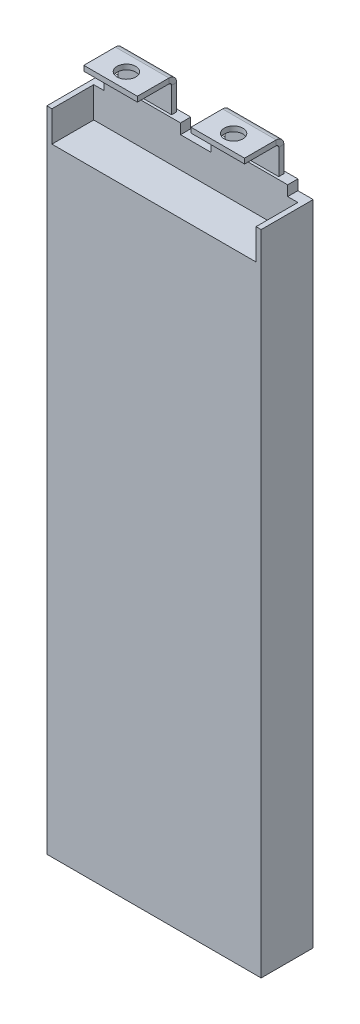
from build123d import *

# Parameters (mm, degrees)
SKETCH1_W                 = 42
SKETCH1_H                 = 127
BOSS_EXTRUDE1_DEPTH       = 5.1
SKETCH2_W                 = 40
SKETCH2_H                 = 6
CUT_EXTRUDE1_DEPTH        = 8.2
SKETCH3_W                 = 15
SKETCH3_H                 = 2
BOSS_EXTRUDE2_DEPTH       = 1
TAB_PROFILE_W             = 10.5
TAB_PROFILE_H             = 1
F_6_CLEARANCE_HOLE1_D     = 3.6576
F_6_CLEARANCE_HOLE1_DEPTH = 1
F_6_CLEARANCE_HOLE2_D     = 3.6576
F_6_CLEARANCE_HOLE2_DEPTH = 1


with BuildPart() as part:
    # Sketch1 → Boss-Extrude1 (new, symmetric)
    with BuildSketch(Plane.XY):
        with Locations((0, 63.5)):
            Rectangle(SKETCH1_W, SKETCH1_H)
    extrude(amount=BOSS_EXTRUDE1_DEPTH, both=True)

    # Sketch2 → Cut-Extrude1 (cut)
    with BuildSketch(Plane.XY.offset(5.1)):
        with Locations((0, 124)):
            Rectangle(SKETCH2_W, SKETCH2_H)
    extrude(amount=-CUT_EXTRUDE1_DEPTH, mode=Mode.SUBTRACT)

    # Sketch3 → Boss-Extrude2 (add, symmetric)
    with BuildSketch(Plane(origin=(0, 0, -4.1), x_dir=(-1, 0, 0), z_dir=(0, 0, -1))):
        with Locations((-10.5, 128)):
            Rectangle(SKETCH3_W, SKETCH3_H)
        with Locations((10.5, 128)):
            Rectangle(SKETCH3_W, SKETCH3_H)
    extrude(amount=BOSS_EXTRUDE2_DEPTH, both=True)

    # Tabs: sweep along a path in Tab Bend
    with BuildLine(Plane(origin=(0, 0, 0), x_dir=(0, 0, -1), z_dir=(1, 0, 0))) as tabs_path:
        Line((4.1, 129), (4.1, 134))
        ThreePointArc((4.1, 134), (3.807106781, 134.707106781), (3.1, 135))
        Line((3.1, 135), (-3.1, 135))
    # Tab Profile → Tabs (sweep)
    with BuildSketch(Plane(origin=(0, 129, 0), x_dir=(1, 0, 0), z_dir=(0, 1, 0))):
        with Locations((-10.5, 4.1)):
            Rectangle(TAB_PROFILE_W, TAB_PROFILE_H)
        with Locations((10.5, 4.1)):
            Rectangle(TAB_PROFILE_W, TAB_PROFILE_H)
    sweep(path=tabs_path.line)

    # #6 Clearance Hole1
    with Locations(Plane(origin=(0, 135.5, 0), x_dir=(1, 0, 0), z_dir=(0, 1, 0))):
        with Locations((-10.5, 0)):
            Hole(F_6_CLEARANCE_HOLE1_D / 2, depth=F_6_CLEARANCE_HOLE1_DEPTH)

    # #6 Clearance Hole2
    with Locations(Plane(origin=(0, 135.5, 0), x_dir=(1, 0, 0), z_dir=(0, 1, 0))):
        with Locations((10.5, 0)):
            Hole(F_6_CLEARANCE_HOLE2_D / 2, depth=F_6_CLEARANCE_HOLE2_DEPTH)


solid = part.part
